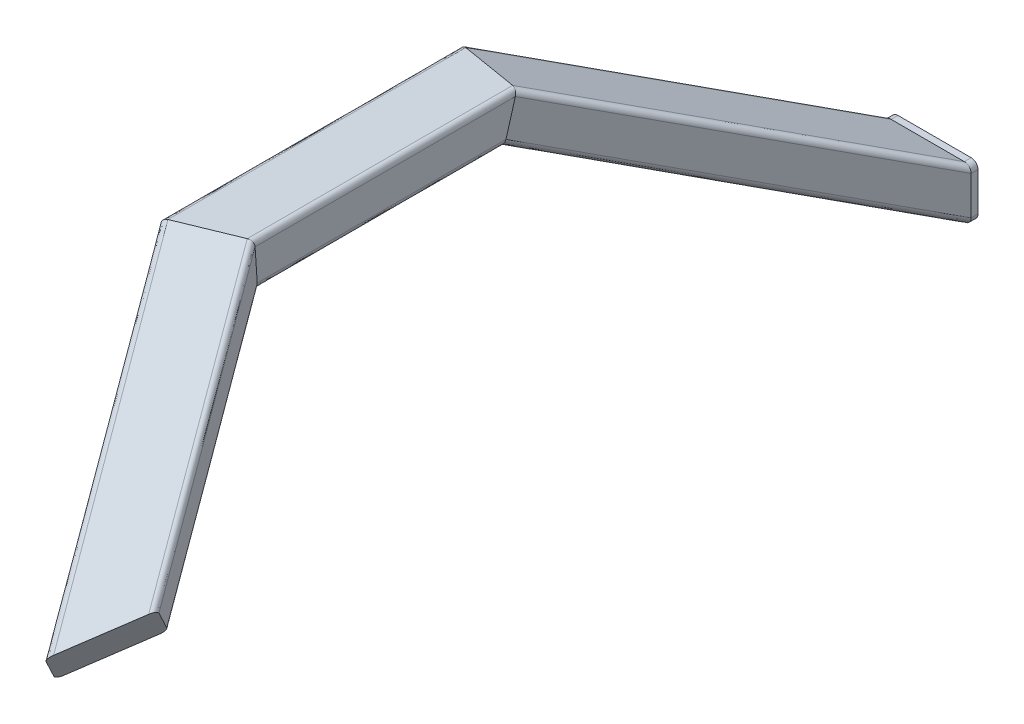
from build123d import *

# Parameters (mm, degrees)
SALIENTE_EXTRUIR1_DEPTH = 10


with BuildPart() as part:
    # Croquis1 → Saliente-Extruir1 (new body)
    with BuildSketch(Plane.XY):
        with BuildLine():
            Line((10, 0), (117, 0))
            ThreePointArc((117, 0), (124.071067812, -2.928932188), (127, -10))
            Line((127, -10), (127, -66.2))
            ThreePointArc((127, -66.2), (124.071067812, -73.271067812), (117, -76.2))
            Line((117, -76.2), (10, -76.2))
            ThreePointArc((10, -76.2), (2.928932188, -73.271067812), (0, -66.2))
            Line((0, -66.2), (0, -10))
            ThreePointArc((0, -10), (2.928932188, -2.928932188), (10, 0))
        make_face()
    extrude(amount=SALIENTE_EXTRUIR1_DEPTH)

    # Barrer1: sweep along a curve in space
    with BuildLine() as barrer1_path:
        Line((-186.5, 131.9, 810), (63.5, -38.1, 1210))
        Line((-186.5, 131.9, 410), (-186.5, 131.9, 810))
        Line((-186.5, 131.9, 410), (63.5, -38.1, 10))
    # Croquis2 → Barrer1 (sweep)
    with BuildSketch(Plane.XY.offset(10)):
        with BuildLine():
            Line((10, -76.2), (117, -76.2))
            ThreePointArc((117, -76.2), (124.071067812, -73.271067812), (127, -66.2))
            Line((127, -66.2), (127, -10))
            ThreePointArc((127, -10), (124.071067812, -2.928932188), (117, 0))
            Line((117, 0), (10, 0))
            ThreePointArc((10, 0), (2.928932188, -2.928932188), (0, -10))
            Line((0, -10), (0, -66.2))
            ThreePointArc((0, -66.2), (2.928932188, -73.271067812), (10, -76.2))
        make_face()
    sweep(path=barrer1_path.line, transition=Transition.RIGHT)


solid = part.part
